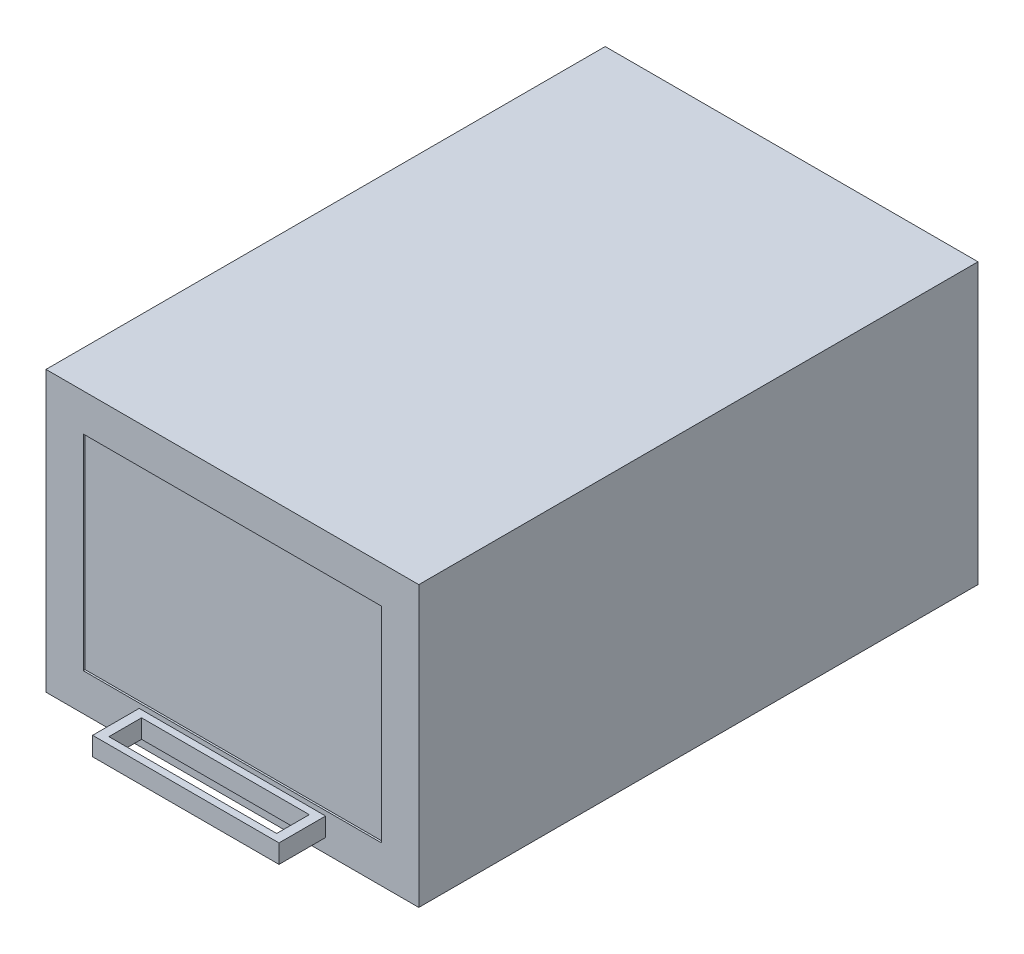
from build123d import *

# Parameters (mm, degrees)
SKETCH_1_W          = 400
SKETCH_1_H          = 600
EXTRUDE_1_DEPTH     = 300
SKETCH_2_W          = 200
SKETCH_2_H          = 20
EXTRUDE_2_DEPTH     = 50
SKETCH_3_W          = 180
SKETCH_3_H          = 35
CUT_EXTRUDE_1_DEPTH = 50
SKETCH_4_W          = 320
SKETCH_4_H          = 220
CUT_EXTRUDE_2_DEPTH = 2


with BuildPart() as part:
    # Эскиз1 → Бобышка-Вытянуть1 (new body)
    with BuildSketch(Plane(origin=(0, 0, 0), x_dir=(1, 0, 0), z_dir=(0, 1, 0))):
        with Locations((-200, -300)):
            Rectangle(SKETCH_1_W, SKETCH_1_H)
    extrude(amount=EXTRUDE_1_DEPTH)

    # Эскиз2 → Бобышка-Вытянуть2 (add)
    with BuildSketch(Plane.XY.offset(600)):
        with Locations((-200, 25)):
            Rectangle(SKETCH_2_W, SKETCH_2_H)
    extrude(amount=EXTRUDE_2_DEPTH)

    # Эскиз3 → Вырез-Вытянуть1 (cut)
    with BuildSketch(Plane(origin=(0, 35, 0), x_dir=(1, 0, 0), z_dir=(0, 1, 0))):
        with Locations((-200, -625)):
            Rectangle(SKETCH_3_W, SKETCH_3_H)
    extrude(amount=-CUT_EXTRUDE_1_DEPTH, mode=Mode.SUBTRACT)

    # Эскиз4 → Вырез-Вытянуть2 (cut)
    with BuildSketch(Plane.XY.offset(600)):
        with Locations((-200, 150)):
            Rectangle(SKETCH_4_W, SKETCH_4_H)
    extrude(amount=-CUT_EXTRUDE_2_DEPTH, mode=Mode.SUBTRACT)


solid = part.part
